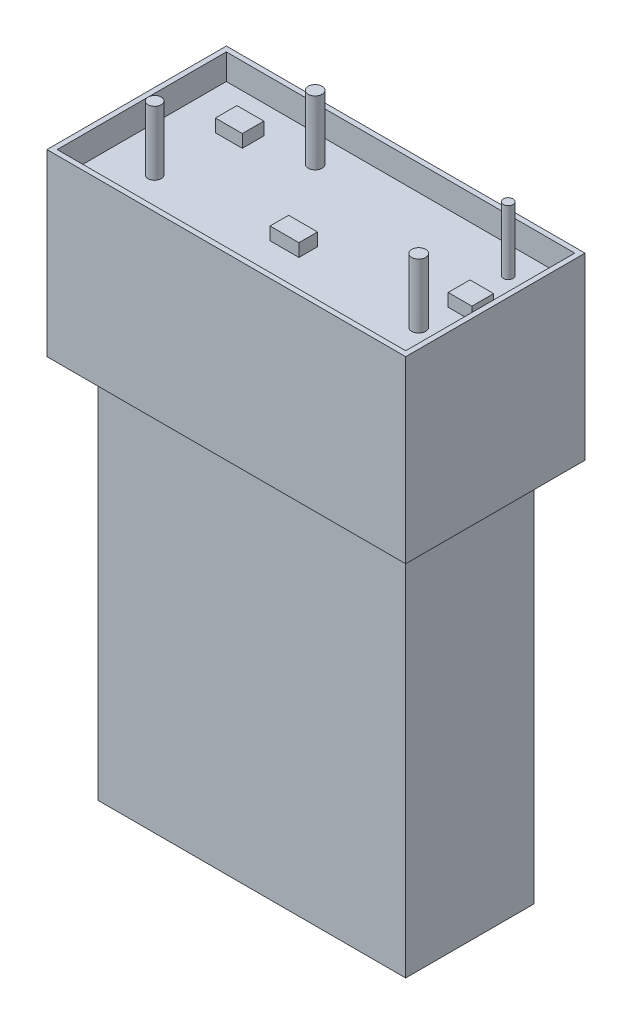
from build123d import *

# Parameters (mm, degrees)
SKETCH1_W           = 12000
SKETCH1_H           = 5000
BOSS_EXTRUDE1_DEPTH = 15000
SKETCH2_W           = 14000
SKETCH2_H           = 7000
BOSS_EXTRUDE2_DEPTH = 6000
SKETCH3_W           = 14000
SKETCH3_H           = 7000
SKETCH3_W_2         = 13600
SKETCH3_H_2         = 6600
BOSS_EXTRUDE3_DEPTH = 1000
SKETCH4_W           = 1049.969098562
SKETCH4_H           = 840.219930543
SKETCH4_W_2         = 1127.878396032
SKETCH4_H_2         = 725.200774448
SKETCH4_W_3         = 924.827627364
SKETCH4_H_3         = 848.717356224
BOSS_EXTRUDE4_DEPTH = 500
SKETCH5_R           = 271.931197036
SKETCH5_R_2         = 273.548394489
SKETCH5_R_3         = 258.072287822
SKETCH5_R_4         = 190.94954072
BOSS_EXTRUDE5_DEPTH = 2500


with BuildPart() as part:
    # Sketch1 → Boss-Extrude1 (new body)
    with BuildSketch(Plane(origin=(0, 0, 0), x_dir=(1, 0, 0), z_dir=(0, 1, 0))):
        Rectangle(SKETCH1_W, SKETCH1_H)
    extrude(amount=BOSS_EXTRUDE1_DEPTH)

    # Sketch2 → Boss-Extrude2 (add)
    with BuildSketch(Plane(origin=(0, 15000, 0), x_dir=(1, 0, 0), z_dir=(0, 1, 0))):
        Rectangle(SKETCH2_W, SKETCH2_H)
    extrude(amount=BOSS_EXTRUDE2_DEPTH)

    # Sketch3 → Boss-Extrude3 (add)
    with BuildSketch(Plane(origin=(0, 21000, 0), x_dir=(1, 0, 0), z_dir=(0, 1, 0))):
        Rectangle(SKETCH3_W, SKETCH3_H)
        Rectangle(SKETCH3_W_2, SKETCH3_H_2, mode=Mode.SUBTRACT)
    extrude(amount=BOSS_EXTRUDE3_DEPTH)

    # Sketch4 → Boss-Extrude4 (add)
    with BuildSketch(Plane(origin=(0, 21000, 0), x_dir=(1, 0, 0), z_dir=(0, 1, 0))):
        with Locations((-4754.176628247, 1773.552806211)):
            Rectangle(SKETCH4_W, SKETCH4_H)
        with Locations((0, -867.663547302)):
            Rectangle(SKETCH4_W_2, SKETCH4_H_2)
        with Locations((5621.523846524, 424.358678112)):
            Rectangle(SKETCH4_W_3, SKETCH4_H_3)
    extrude(amount=BOSS_EXTRUDE4_DEPTH)

    # Sketch5 → Boss-Extrude5 (add)
    with BuildSketch(Plane(origin=(0, 21000, 0), x_dir=(1, 0, 0), z_dir=(0, 1, 0))):
        with Locations(Location((-2270.095584956, 2238.373193315, 0), (0, 0, 90))):
            Circle(SKETCH5_R)
        with Locations(Location((5262.848698071, -1254.612412688, 0), (0, 0, 90))):
            Circle(SKETCH5_R_2)
        with Locations(Location((-5042.358088057, -1254.612412688, 0), (0, 0, 90))):
            Circle(SKETCH5_R_3)
        with Locations(Location((5262.848698071, 2238.373193315, 0), (0, 0, 90))):
            Circle(SKETCH5_R_4)
    extrude(amount=BOSS_EXTRUDE5_DEPTH)


solid = part.part
